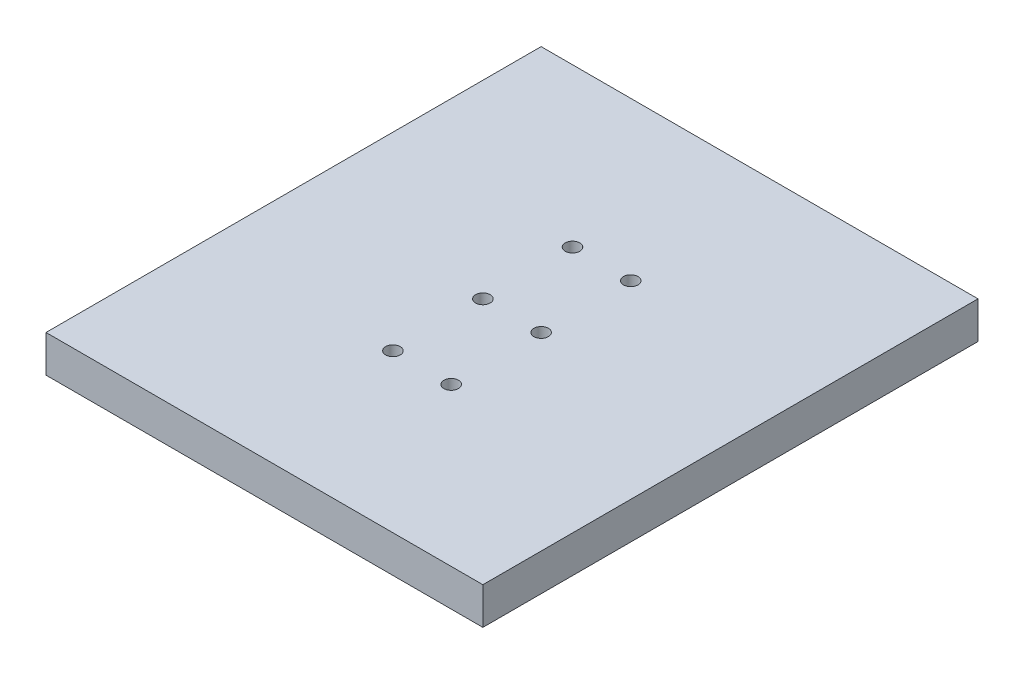
from build123d import *

# Parameters (mm, degrees)
CROQUIS1_W              = 150
CROQUIS1_H              = 170
CROQUIS1_R              = 2.501310034
CROQUIS1_R_2            = 2.5
SALIENTE_EXTRUIR1_DEPTH = 12.7


with BuildPart() as part:
    # Croquis1 → Saliente-Extruir1 (new body)
    with BuildSketch(Plane(origin=(0, 0, 0), x_dir=(1, 0, 0), z_dir=(0, 1, 0))):
        Rectangle(CROQUIS1_W, CROQUIS1_H)
        with Locations(Location((10, 0, 0), (0, 0, 270))):
            Circle(CROQUIS1_R, mode=Mode.SUBTRACT)
        with Locations(Location((-10, 0, 0), (0, 0, 270))):
            Circle(CROQUIS1_R_2, mode=Mode.SUBTRACT)
        with Locations(Location((10, 30.76978977, 0), (0, 0, 270))):
            Circle(CROQUIS1_R_2, mode=Mode.SUBTRACT)
        with Locations(Location((-10, 30.76978977, 0), (0, 0, 270))):
            Circle(CROQUIS1_R_2, mode=Mode.SUBTRACT)
        with Locations(Location((10, -30.884205668, 0), (0, 0, 270))):
            Circle(CROQUIS1_R_2, mode=Mode.SUBTRACT)
        with Locations(Location((-10, -30.884205668, 0), (0, 0, 270))):
            Circle(CROQUIS1_R_2, mode=Mode.SUBTRACT)
    extrude(amount=SALIENTE_EXTRUIR1_DEPTH)


solid = part.part
